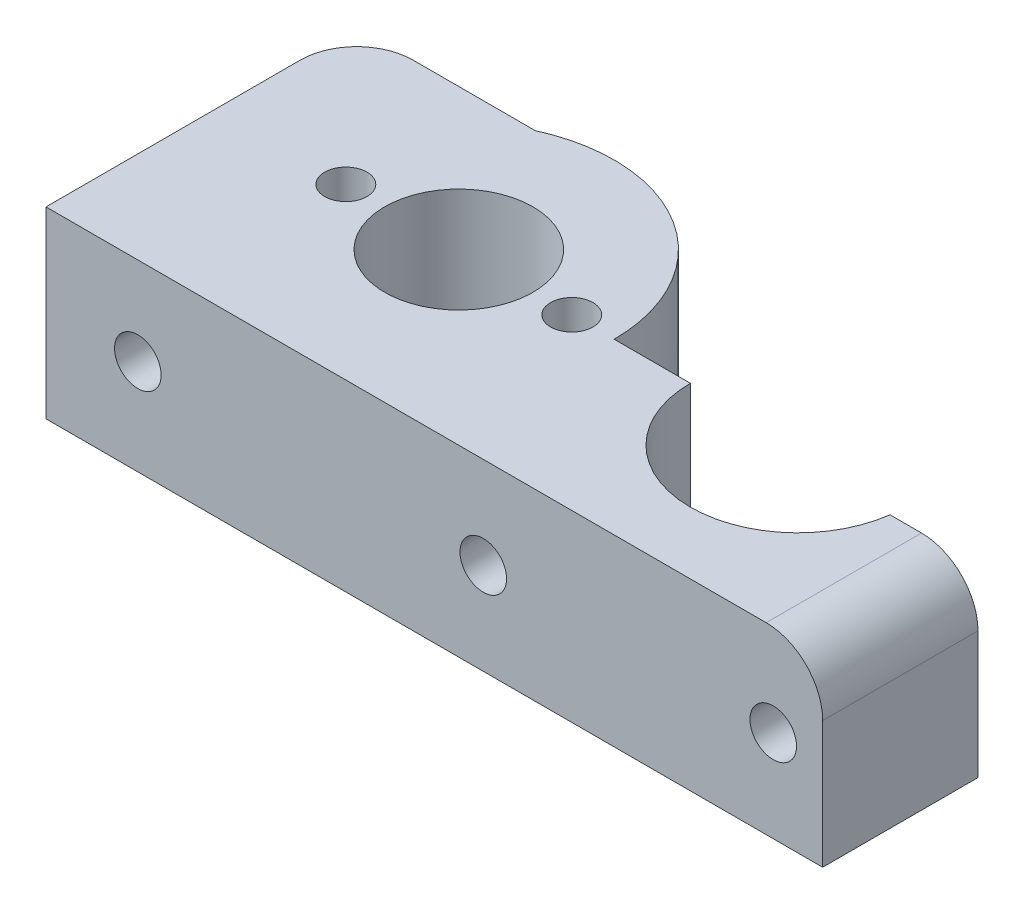
from build123d import *

# Parameters (mm, degrees)
SKETCH1_R           = 1.5
SKETCH1_R_2         = 5.25
BOSS_EXTRUDE4_DEPTH = 13
FILLET2_R           = 4
FILLET3_R           = 4
SKETCH2_R           = 1.65
CUT_EXTRUDE1_DEPTH  = 40.402671632


with BuildPart() as part:
    # Sketch1 → Boss-Extrude4 (new body)
    with BuildSketch(Plane(origin=(0, 0, 0), x_dir=(1, 0, 0), z_dir=(0, 1, 0))):
        with BuildLine():
            Line((-29.23303836, -12), (25.76696164, -12))
            Line((25.76696164, -12), (25.76696164, -1))
            Line((25.76696164, -1), (19.533923281, -1))
            ThreePointArc((19.533923281, -1), (11.498909656, -7.583462828), (4.4, 0))
            Line((4.4, 0), (-1, 0))
            ThreePointArc((-1, 0), (-6.058970318, 9.257654472), (-16.582575695, 10))
            Line((-16.582575695, 10), (-29.23303836, 10))
            Line((-29.23303836, 10), (-29.23303836, -12))
        make_face()
        with Locations((-4, 0)):
            Circle(SKETCH1_R, mode=Mode.SUBTRACT)
        with Locations((-20, 0)):
            Circle(SKETCH1_R, mode=Mode.SUBTRACT)
        with Locations((-12, 0)):
            Circle(SKETCH1_R_2, mode=Mode.SUBTRACT)
    extrude(amount=BOSS_EXTRUDE4_DEPTH)

    # Fillet2
    fillet2_edges = [part.edges().sort_by_distance(p)[0] for p in [
        (25.76696164, 13, 6.5),
    ]]
    fillet(fillet2_edges, radius=FILLET2_R)

    # Fillet3
    fillet3_edges = [part.edges().sort_by_distance(p)[0] for p in [
        (-29.23303836, 6.5, -10),
    ]]
    fillet(fillet3_edges, radius=FILLET3_R)

    # Sketch2 → Cut-Extrude1 (cut, through all)
    with BuildSketch(Plane.XY.offset(12)):
        with Locations((22.26696164, 6.5)):
            Circle(SKETCH2_R)
        with Locations((1.73303836, 6.5)):
            Circle(SKETCH2_R)
        with Locations((-22.73, 6.761910465)):
            Circle(SKETCH2_R)
    extrude(amount=-CUT_EXTRUDE1_DEPTH, mode=Mode.SUBTRACT)


solid = part.part
